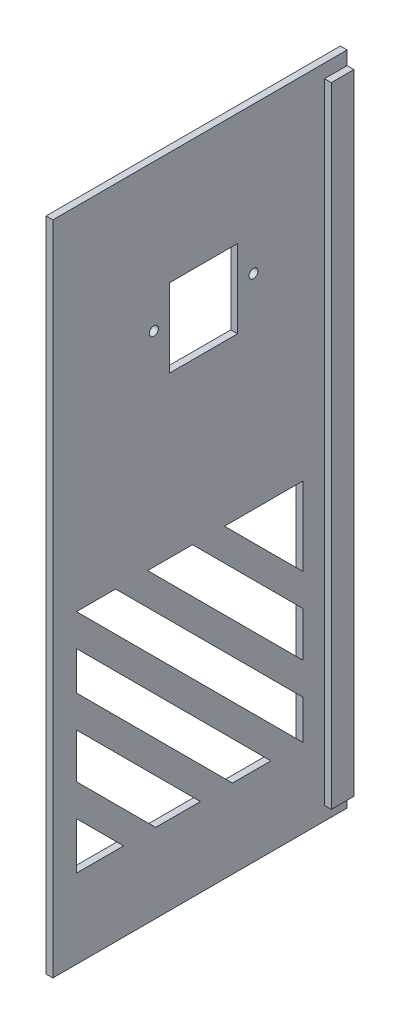
from build123d import *

# Parameters (mm, degrees)
SKETCH_1_W          = 130
SKETCH_1_H          = 290
EXTRUDE_1_DEPTH     = 3
SKETCH_3_W          = 30
SKETCH_3_H          = 34.54
CUT_EXTRUDE_3_DEPTH = 3
SKETCH_4_R          = 2
CUT_EXTRUDE_4_DEPTH = 3
CUT_EXTRUDE_6_DEPTH = 10
SKETCH_6_W          = 10
SKETCH_6_H          = 290
EXTRUDE_2_DEPTH     = 3
SKETCH_7_W          = 3
SKETCH_7_H          = 10
CUT_EXTRUDE_7_DEPTH = 6
SKETCH_8_W          = 3
SKETCH_8_H          = 10
CUT_EXTRUDE_8_DEPTH = 6


with BuildPart() as part:
    # 草图1 → 凸台-拉伸1 (new body)
    with BuildSketch(Plane(origin=(0, 0, 0), x_dir=(0, 0, -1), z_dir=(1, 0, 0))):
        with Locations((28.545134703, -106.027707237)):
            Rectangle(SKETCH_1_W, SKETCH_1_H)
    extrude(amount=EXTRUDE_1_DEPTH)

    # 草图3 → 切除-拉伸3 (cut)
    with BuildSketch(Plane(origin=(3, 0, 0), x_dir=(0, 0, -1), z_dir=(1, 0, 0))):
        with Locations((30.181306513, -28.135365108)):
            Rectangle(SKETCH_3_W, SKETCH_3_H)
    extrude(amount=-CUT_EXTRUDE_3_DEPTH, mode=Mode.SUBTRACT)

    # 草图4 → 切除-拉伸4 (cut)
    with BuildSketch(Plane(origin=(3, 0, 0), x_dir=(0, 0, -1), z_dir=(1, 0, 0))):
        with Locations((52.181306513, -25.865365108)):
            Circle(SKETCH_4_R)
        with Locations((8.181306513, -25.865365108)):
            Circle(SKETCH_4_R)
    extrude(amount=-CUT_EXTRUDE_4_DEPTH, mode=Mode.SUBTRACT)

    # 草图5 → 切除-拉伸6 (cut)
    with BuildSketch(Plane.ZY):
        Polygon((-73.995657993, -116.121202928), (-73.995657993, -150.753178318), (-39.363682603, -116.121202928), align=None)
        Polygon((-25.221546979, -116.121202928), (-73.995657993, -164.895313942), (-73.995657993, -184.694303815), (-5.422557106, -116.121202928), align=None)
        Polygon((8.719578518, -116.121202928), (-73.995657993, -198.836439439), (-73.995657993, -216.121202928), (26.004342007, -116.121202928), align=None)
        Polygon((26.004342007, -130.263338551), (-59.85352237, -216.121202928), (-42.882959621, -216.121202928), (26.004342007, -147.2339013), align=None)
        Polygon((26.004342007, -161.376036924), (-28.740823997, -216.121202928), (-8.941834124, -216.121202928), (26.004342007, -181.175026797), align=None)
        Polygon((26.004342007, -195.317162421), (5.2003015, -216.121202928), (26.004342007, -216.121202928), align=None)
    extrude(amount=-CUT_EXTRUDE_6_DEPTH, mode=Mode.SUBTRACT)

    # 草图6 → 凸台-拉伸2 (add)
    with BuildSketch(Plane(origin=(3, 0, 0), x_dir=(0, 0, -1), z_dir=(1, 0, 0))):
        with Locations((88.545134703, -106.027707237)):
            Rectangle(SKETCH_6_W, SKETCH_6_H)
    extrude(amount=EXTRUDE_2_DEPTH)

    # 草图7 → 切除-拉伸7 (cut)
    with BuildSketch(Plane(origin=(0, 38.972292763, 0), x_dir=(1, 0, 0), z_dir=(0, 1, 0))):
        with Locations((4.5, 88.545134703)):
            Rectangle(SKETCH_7_W, SKETCH_7_H)
    extrude(amount=-CUT_EXTRUDE_7_DEPTH, mode=Mode.SUBTRACT)

    # 草图8 → 切除-拉伸8 (cut)
    with BuildSketch(Plane.XZ.offset(251.027707237)):
        with Locations((4.5, -88.545134703)):
            Rectangle(SKETCH_8_W, SKETCH_8_H)
    extrude(amount=-CUT_EXTRUDE_8_DEPTH, mode=Mode.SUBTRACT)


solid = part.part
